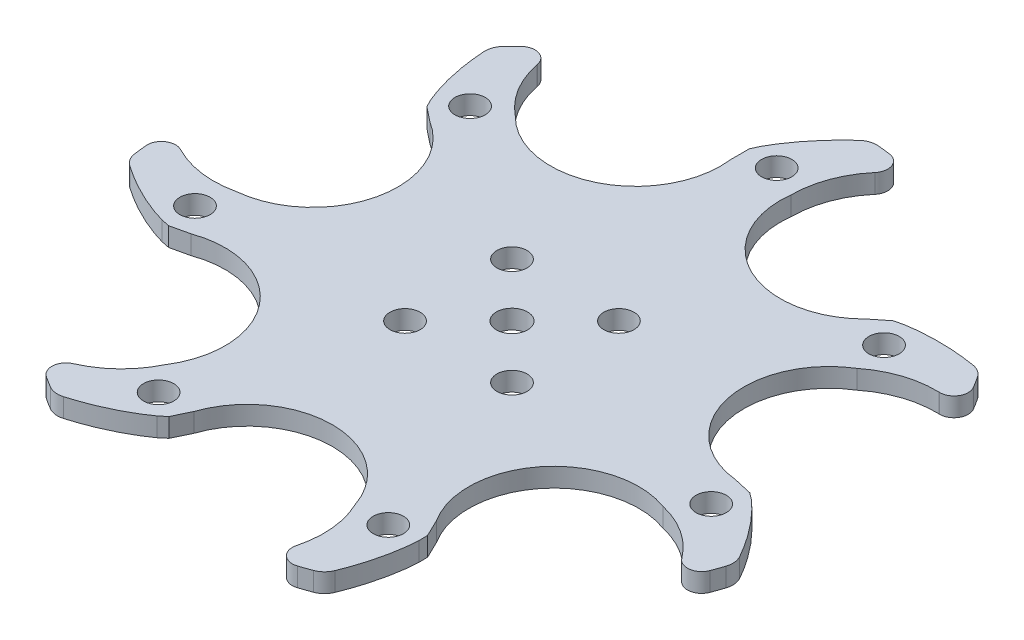
from build123d import *

# Parameters (mm, degrees)
EXTRUDE_1_DEPTH     = 2
MM_PRESS_2_D        = 3.2
MM_PRESS_2_2_D      = 3.2
SKETCH_8_R          = 1.65
CUT_EXTRUDE_1_DEPTH = 49.327311862
EXTRUDE_2_DEPTH     = 2
CUT_EXTRUDE_2_DEPTH = 10


with BuildPart() as part:
    # 草图1 → 凸台-拉伸1 (new body)
    with BuildSketch(Plane(origin=(0, 0, 0), x_dir=(1, 0, 0), z_dir=(0, 1, 0))):
        with BuildLine():
            ThreePointArc((-8.522404447, -25.107142857), (0, -19), (8.522404447, -25.107142857))
            Line((8.522404447, -25.107142857), (10.691823142, -29.611987197))
            ThreePointArc((10.691823142, -29.611987197), (14.983587764, -31.113740589), (16.485341156, -26.821975967))
            Line((16.485341156, -26.821975967), (14.315922461, -22.317131628))
            ThreePointArc((14.315922461, -22.317131628), (14.854798167, -11.846306235), (24.94318698, -8.990963423))
            Line((24.94318698, -8.990963423), (29.817826541, -10.103568092))
            ThreePointArc((29.817826541, -10.103568092), (33.667816096, -7.684459321), (31.248707324, -3.834469766))
            Line((31.248707324, -3.834469766), (26.374067764, -2.721865096))
            ThreePointArc((26.374067764, -2.721865096), (18.523630331, 4.227897745), (22.58124097, 13.895594851))
            Line((22.58124097, 13.895594851), (26.490398382, 17.013043861))
            ThreePointArc((26.490398382, 17.013043861), (26.999492209, 21.53137655), (22.48115952, 22.040470378))
            Line((22.48115952, 22.040470378), (18.572002107, 18.923021369))
            ThreePointArc((18.572002107, 18.923021369), (8.243791043, 17.11840849), (3.215159935, 26.318486784))
            Line((3.215159935, 26.318486784), (3.215159935, 31.318486784))
            ThreePointArc((3.215159935, 31.318486784), (0, 34.533646719), (-3.215159935, 31.318486784))
            Line((-3.215159935, 31.318486784), (-3.215159935, 26.318486784))
            ThreePointArc((-3.215159935, 26.318486784), (-8.243791043, 17.11840849), (-18.572002107, 18.923021369))
            Line((-18.572002107, 18.923021369), (-22.48115952, 22.040470378))
            ThreePointArc((-22.48115952, 22.040470378), (-26.999492209, 21.53137655), (-26.490398382, 17.013043861))
            Line((-26.490398382, 17.013043861), (-22.58124097, 13.895594851))
            ThreePointArc((-22.58124097, 13.895594851), (-18.523630331, 4.227897745), (-26.374067764, -2.721865096))
            Line((-26.374067764, -2.721865096), (-31.248707324, -3.834469766))
            ThreePointArc((-31.248707324, -3.834469766), (-33.667816096, -7.684459321), (-29.817826541, -10.103568092))
            Line((-29.817826541, -10.103568092), (-24.94318698, -8.990963423))
            ThreePointArc((-24.94318698, -8.990963423), (-14.854798167, -11.846306235), (-14.315922461, -22.317131628))
            Line((-14.315922461, -22.317131628), (-16.485341156, -26.821975967))
            ThreePointArc((-16.485341156, -26.821975967), (-14.983587764, -31.113740589), (-10.691823142, -29.611987197))
            Line((-10.691823142, -29.611987197), (-8.522404447, -25.107142857))
        make_face()
    extrude(amount=EXTRUDE_1_DEPTH)

    # mm Press _2 (through all)
    with Locations(Plane(origin=(0, 2, 0), x_dir=(1, 0, 0), z_dir=(0, 1, 0))):
        with Locations((5.655, -5.655), (5.655, 5.655), (-5.655, 5.655), (-5.655, -5.655)):
            Hole(MM_PRESS_2_D / 2)

    # mm Press _2 2 (through all)
    with Locations(Plane(origin=(0, 2, 0), x_dir=(1, 0, 0), z_dir=(0, 1, 0))):
        with Locations((-27.297981541, -6.230586151), (-21.891281509, 17.457714452), (0, 28), (21.891281509, 17.457714452), (27.297981541, -6.230586151), (12.148744695, -25.227128301), (-12.148744695, -25.227128301)):
            Hole(MM_PRESS_2_2_D / 2)

    # 草图8 → 切除-拉伸1 (cut, through all)
    with BuildSketch(Plane(origin=(0, 2, 0), x_dir=(1, 0, 0), z_dir=(0, 1, 0))):
        with Locations(Location((0, 0, 0), (0, 0, 270))):
            Circle(SKETCH_8_R)
    extrude(amount=-CUT_EXTRUDE_1_DEPTH, mode=Mode.SUBTRACT)

    # 草图9 → 凸台-拉伸2 (add)
    with BuildSketch(Plane.XZ):
        with BuildLine():
            ThreePointArc((29.817826541, 10.103568092), (31.7036921, 9.963573711), (33.184658751, 8.787637866))
            add(Edge.make_bspline(
                [(33.184658751, 8.787637866), (33.212444755, 8.833484216), (33.284734799, 8.95360547), (33.400398872, 9.149380685), (33.517732548, 9.352601177), (33.590688856, 9.481453879), (33.620499074, 9.534536524)],
                knots=[0.790412245, 0.790412245, 0.790412245, 0.790412245, 0.80972492, 0.840917534, 0.872328308, 0.894260439, 0.894260439, 0.894260439, 0.894260439], degree=3))
            ThreePointArc((33.620499074, 9.534536524), (33.867349351, 10.321043467), (33.776017877, 11.140303372))
            ThreePointArc((33.776017877, 11.140303372), (33.562238871, 11.768681524), (33.336770484, 12.392960766))
            ThreePointArc((33.336770484, 12.392960766), (32.143995066, 13.355052421), (30.728686654, 12.76748485))
            Line((30.728686654, 12.76748485), (30.714079317, 12.747934687))
            ThreePointArc((30.714079317, 12.747934687), (28.162215888, 10.357049588), (24.94318698, 8.990963423))
            Line((24.94318698, 8.990963423), (29.817826541, 10.103568092))
        make_face()
        with BuildLine():
            ThreePointArc((9.183178553, 31.961441437), (9.46138697, 28.475621793), (8.522404447, 25.107142857))
            Line((8.522404447, 25.107142857), (10.691823142, 29.611987197))
            ThreePointArc((10.691823142, 29.611987197), (11.977093101, 30.999131193), (13.819844369, 31.423813538))
            add(Edge.make_bspline(
                [(13.819844369, 31.423813538), (13.80132454, 31.474122243), (13.752482066, 31.605535252), (13.67153421, 31.818028916), (13.585806381, 32.036469982), (13.530552797, 32.173847866), (13.507637481, 32.23025092)],
                knots=[0.790412245, 0.790412245, 0.790412245, 0.790412245, 0.80972492, 0.840917534, 0.872328308, 0.894260439, 0.894260439, 0.894260439, 0.894260439], degree=3))
            ThreePointArc((13.507637481, 32.23025092), (13.046630222, 32.913625297), (12.349162793, 33.353019671))
            ThreePointArc((12.349162793, 33.353019671), (11.724587941, 33.577667883), (11.095929536, 33.79062134))
            ThreePointArc((11.095929536, 33.79062134), (9.600052681, 33.457926303), (9.177001146, 31.98505124))
            Line((9.177001146, 31.98505124), (9.183178553, 31.961441437))
        make_face()
        with BuildLine():
            ThreePointArc((-19.262842964, 27.107330891), (-16.364059313, 25.15146999), (-14.315922461, 22.317131628))
            Line((-14.315922461, 22.317131628), (-16.485341156, 26.821975967))
            ThreePointArc((-16.485341156, 26.821975967), (-16.768501291, 28.69171062), (-15.951594696, 30.397216687))
            add(Edge.make_bspline(
                [(-15.951594696, 30.397216687), (-16.00247455, 30.414104266), (-16.135670161, 30.457852353), (-16.352274561, 30.527052404), (-16.57650909, 30.596223465), (-16.718365491, 30.638678182), (-16.776750641, 30.655928996)],
                knots=[0.790412245, 0.790412245, 0.790412245, 0.790412245, 0.80972492, 0.840917534, 0.872328308, 0.894260439, 0.894260439, 0.894260439, 0.894260439], degree=3))
            ThreePointArc((-16.776750641, 30.655928996), (-17.598467567, 30.721575963), (-18.376863751, 30.450231879))
            ThreePointArc((-18.376863751, 30.450231879), (-18.941916847, 30.101985466), (-19.500372669, 29.743254842))
            ThreePointArc((-19.500372669, 29.743254842), (-20.172925177, 28.366299261), (-19.285153402, 27.117221671))
            Line((-19.285153402, 27.117221671), (-19.262842964, 27.107330891))
        make_face()
        with BuildLine():
            ThreePointArc((-33.203550839, 1.840847295), (-29.867035167, 2.887748289), (-26.374067764, 2.721865096))
            Line((-26.374067764, 2.721865096), (-31.248707324, 3.834469766))
            ThreePointArc((-31.248707324, 3.834469766), (-32.887072196, 4.778846746), (-33.711157602, 6.48089568))
            add(Edge.make_bspline(
                [(-33.711157602, 6.48089568), (-33.756083912, 6.451645442), (-33.87333365, 6.374785406), (-34.062487062, 6.248582793), (-34.256375118, 6.11639663), (-34.378013572, 6.031958913), (-34.427903346, 5.997067271)],
                knots=[0.790412245, 0.790412245, 0.790412245, 0.790412245, 0.80972492, 0.840917534, 0.872328308, 0.894260439, 0.894260439, 0.894260439, 0.894260439], degree=3))
            ThreePointArc((-34.427903346, 5.997067271), (-34.991560335, 5.395553323), (-35.264737071, 4.617798412))
            ThreePointArc((-35.264737071, 4.617798412), (-35.344771904, 3.958894025), (-35.412496518, 3.298610796))
            ThreePointArc((-35.412496518, 3.298610796), (-34.755278925, 1.914270308), (-33.225194093, 1.829571092))
            Line((-33.225194093, 1.829571092), (-33.203550839, 1.840847295))
        make_face()
        with BuildLine():
            ThreePointArc((-24.658288206, -25.629954459), (-23.166198763, -25.97924323), (-22.145985961, -24.835783835))
            Line((-22.145985961, -24.835783835), (-22.141307703, -24.811831861))
            ThreePointArc((-22.141307703, -24.811831861), (-20.879524364, -21.550506773), (-18.572002107, -18.923021369))
            Line((-18.572002107, -18.923021369), (-22.48115952, -22.040470378))
            ThreePointArc((-22.48115952, -22.040470378), (-24.241006963, -22.732586198), (-26.085531251, -22.31567196))
            add(Edge.make_bspline(
                [(-26.085531251, -22.31567196), (-26.09067359, -22.36903399), (-26.10368601, -22.508624974), (-26.122952057, -22.735197109), (-26.140491979, -22.969201619), (-26.150316249, -23.116948448), (-26.154142631, -23.177708427)],
                knots=[0.790412245, 0.790412245, 0.790412245, 0.790412245, 0.80972492, 0.840917534, 0.872328308, 0.894260439, 0.894260439, 0.894260439, 0.894260439], degree=3))
            ThreePointArc((-26.154142631, -23.177708427), (-26.035294473, -23.993431018), (-25.597544107, -24.691931446))
            ThreePointArc((-25.597544107, -24.691931446), (-25.132292815, -25.165325364), (-24.658288206, -25.629954459))
        make_face()
        with BuildLine():
            ThreePointArc((3.215159935, -31.318486784), (2.65903094, -33.125918075), (1.18303218, -34.308083458))
            add(Edge.make_bspline(
                [(1.18303218, -34.308083458), (1.221546098, -34.345374581), (1.322569614, -34.442581656), (1.487698657, -34.598909874), (1.659714789, -34.758522563), (1.769102579, -34.858322127), (1.814220933, -34.899196941)],
                knots=[0.790412245, 0.790412245, 0.790412245, 0.790412245, 0.80972492, 0.840917534, 0.872328308, 0.894260439, 0.894260439, 0.894260439, 0.894260439], degree=3))
            ThreePointArc((1.814220933, -34.899196941), (2.52607915, -35.314872426), (3.345121665, -35.408133301))
            ThreePointArc((3.345121665, -35.408133301), (4.005315368, -35.339541475), (4.664114062, -35.258641251))
            ThreePointArc((4.664114062, -35.258641251), (5.867501571, -34.309856737), (5.609601295, -32.799286977))
            Line((5.609601295, -32.799286977), (5.593791734, -32.780695556))
            ThreePointArc((5.593791734, -32.780695556), (3.83069415, -29.760790685), (3.215159935, -26.318486784))
            Line((3.215159935, -26.318486784), (3.215159935, -31.318486784))
        make_face()
        with BuildLine():
            ThreePointArc((26.490398382, -17.013043861), (27.55676431, -18.574757995), (27.56074825, -20.465808354))
            add(Edge.make_bspline(
                [(27.56074825, -20.465808354), (27.61391666, -20.458947596), (27.752903343, -20.440571851), (27.97808194, -20.408937815), (28.210122468, -20.373967072), (28.356351081, -20.350668265), (28.416439131, -20.340878344)],
                knots=[0.790412245, 0.790412245, 0.790412245, 0.790412245, 0.80972492, 0.840917534, 0.872328308, 0.894260439, 0.894260439, 0.894260439, 0.894260439], degree=3))
            ThreePointArc((28.416439131, -20.340878344), (29.185263651, -20.043494605), (29.768842594, -19.461288586))
            ThreePointArc((29.768842594, -19.461288586), (30.126839386, -18.90236206), (30.474343312, -18.336852036))
            ThreePointArc((30.474343312, -18.336852036), (30.482853548, -16.804448327), (29.141044361, -16.064258042))
            Line((29.141044361, -16.064258042), (29.116651902, -16.065026893))
            ThreePointArc((29.116651902, -16.065026893), (25.656321837, -15.560592202), (22.58124097, -13.895594851))
            Line((22.58124097, -13.895594851), (26.490398382, -17.013043861))
        make_face()
    extrude(amount=-EXTRUDE_2_DEPTH)

    # 草图10 → 切除-拉伸2 (cut)
    with BuildSketch(Plane.XZ):
        with BuildLine():
            Line((29.032198584, 3.712254696), (28.312582717, 3.164318484))
            Line((28.312582716, 3.164318484), (31.248707324, 3.834469766))
            ThreePointArc((31.248707324, 3.834469766), (33.527821714, 5.798593762), (33.184658751, 8.787637866))
            add(Edge.make_bspline(
                [(29.032198584, 3.712254696), (29.07336573, 3.748731887), (29.156787944, 3.822650251), (29.282094586, 3.936557796), (29.409471852, 4.054520385), (29.676591101, 4.307005221), (30.038604175, 4.667248491), (30.491903924, 5.150673711), (30.910968793, 5.62530964), (31.333991802, 6.134386446), (31.757858219, 6.676746667), (32.228894866, 7.318189582), (32.709014608, 8.0225916), (33.036301483, 8.542851347), (33.184658751, 8.787637866)],
                knots=[0, 0, 0, 0, 0.019814698, 0.040153039, 0.06100407, 0.08235681, 0.172565022, 0.244952026, 0.32107033, 0.400635879, 0.483373462, 0.569018146, 0.687296458, 0.790412245, 0.790412245, 0.790412245, 0.790412245], degree=3))
        make_face()
        with BuildLine():
            Line((21.003637335, -20.383733914), (20.1265704, -20.162748213))
            Line((20.1265704, -20.162748213), (22.48115952, -22.040470378))
            ThreePointArc((22.48115952, -22.040470378), (25.437778075, -22.597742479), (27.56074825, -20.465808354))
            add(Edge.make_bspline(
                [(21.003637335, -20.383733914), (21.057823647, -20.393176527), (21.167628251, -20.412311294), (21.334812169, -20.439259779), (21.506457462, -20.465298865), (21.870404182, -20.516719383), (22.377765172, -20.575144597), (23.038349999, -20.628137917), (23.670717983, -20.659845362), (24.332480789, -20.673173872), (25.020791473, -20.666409915), (25.815978284, -20.634748079), (26.666051721, -20.570933334), (27.276867199, -20.50243987), (27.56074825, -20.465808354)],
                knots=[0, 0, 0, 0, 0.019814698, 0.040153039, 0.06100407, 0.08235681, 0.172565022, 0.244952026, 0.32107033, 0.400635879, 0.483373462, 0.569018146, 0.687296458, 0.790412245, 0.790412245, 0.790412245, 0.790412245], degree=3))
        make_face()
        with BuildLine():
            ThreePointArc((16.485341156, 26.821975967), (16.37073176, 29.828470631), (13.819844369, 31.423813538))
            add(Edge.make_bspline(
                [(15.198922151, 25.012839803), (15.19607043, 25.06776873), (15.190291625, 25.17907819), (15.179362534, 25.34806706), (15.166554094, 25.521203089), (15.135699628, 25.887467047), (15.079761559, 26.39510827), (14.984432273, 27.05092298), (14.874629632, 27.674491749), (14.740367891, 28.322628652), (14.580609983, 28.992176828), (14.372796264, 29.760381224), (14.121422353, 30.574941428), (13.918726932, 31.155201257), (13.819844369, 31.423813538)],
                knots=[0, 0, 0, 0, 0.019814698, 0.040153039, 0.06100407, 0.08235681, 0.172565022, 0.244952026, 0.32107033, 0.400635879, 0.483373462, 0.569018146, 0.687296458, 0.790412245, 0.790412245, 0.790412245, 0.790412245], degree=3))
            Line((15.198922151, 25.012839803), (15.178642776, 24.108588823))
            Line((15.178642776, 24.108588823), (16.485341156, 26.821975967))
        make_face()
        with BuildLine():
            ThreePointArc((-10.691823142, 29.611987197), (-13.113853112, 31.396900724), (-15.951594696, 30.397216687))
            add(Edge.make_bspline(
                [(-10.079452664, 27.47824637), (-10.124175848, 27.51026443), (-10.214804113, 27.575146692), (-10.353739109, 27.671964821), (-10.497088238, 27.769899328), (-10.802682376, 27.974138178), (-11.234449083, 28.24691316), (-11.806622506, 28.581275506), (-12.362609028, 28.884217113), (-12.95305369, 29.183353807), (-13.57613496, 29.475906505), (-14.306311076, 29.792398803), (-15.099888959, 30.103736746), (-15.679932888, 30.30704917), (-15.951594696, 30.397216687)],
                knots=[0, 0, 0, 0, 0.019814698, 0.040153039, 0.06100407, 0.08235681, 0.172565022, 0.244952026, 0.32107033, 0.400635879, 0.483373462, 0.569018146, 0.687296458, 0.790412245, 0.790412245, 0.790412245, 0.790412245], degree=3))
            Line((-10.079452664, 27.47824637), (-9.385124762, 26.898600052))
            Line((-9.385124762, 26.898600052), (-10.691823142, 29.611987197))
        make_face()
        with BuildLine():
            ThreePointArc((-29.817826541, 10.103568092), (-32.723439116, 9.322824192), (-33.711157602, 6.48089568))
            add(Edge.make_bspline(
                [(-27.767794039, 9.251972966), (-27.820711216, 9.236969907), (-27.92794401, 9.206567304), (-28.090264024, 9.158308667), (-28.256209026, 9.107294971), (-28.606424217, 8.995712693), (-29.088890424, 8.828216308), (-29.707049727, 8.589344625), (-30.290550939, 8.343537861), (-30.892561649, 8.068418313), (-31.509773376, 7.763677384), (-32.212474381, 7.390132429), (-32.950675903, 6.963804289), (-33.471283432, 6.637070907), (-33.711157602, 6.48089568)],
                knots=[0, 0, 0, 0, 0.019814698, 0.040153039, 0.06100407, 0.08235681, 0.172565022, 0.244952026, 0.32107033, 0.400635879, 0.483373462, 0.569018146, 0.687296458, 0.790412245, 0.790412245, 0.790412245, 0.790412245], degree=3))
            Line((-27.767794039, 9.251972966), (-26.881701933, 9.433416811))
            Line((-26.881701933, 9.433416811), (-29.817826541, 10.103568092))
        make_face()
        with BuildLine():
            ThreePointArc((-26.490398382, -17.013043861), (-27.69160803, -19.771529107), (-26.085531251, -22.31567196))
            add(Edge.make_bspline(
                [(-24.546420143, -15.941224787), (-24.5676836, -15.991951356), (-24.610772441, -16.094745043), (-24.674247193, -16.251740709), (-24.737828095, -16.413288254), (-24.868945158, -16.756667929), (-25.03880397, -17.238307486), (-25.23746259, -17.870537949), (-25.409090178, -18.479995578), (-25.569340592, -19.122200736), (-25.715909757, -19.794759156), (-25.861987462, -20.577054395), (-25.988931821, -21.420014833), (-26.058074861, -22.030757121), (-26.085531251, -22.31567196)],
                knots=[0, 0, 0, 0, 0.019814698, 0.040153039, 0.06100407, 0.08235681, 0.172565022, 0.244952026, 0.32107033, 0.400635879, 0.483373462, 0.569018146, 0.687296458, 0.790412245, 0.790412245, 0.790412245, 0.790412245], degree=3))
            Line((-24.546420143, -15.941224787), (-24.135809262, -15.135321696))
            Line((-24.135809262, -15.135321696), (-26.490398382, -17.013043861))
        make_face()
        with BuildLine():
            Line((-2.841091224, -29.130355134), (-3.215159935, -28.306854261))
            Line((-3.215159935, -28.306854261), (-3.215159935, -31.318486784))
            ThreePointArc((-3.215159935, -31.318486784), (-1.807431291, -33.977517723), (1.18303218, -34.308083458))
            add(Edge.make_bspline(
                [(-2.841091224, -29.130355134), (-2.814689143, -29.178607072), (-2.761187256, -29.2763861), (-2.678018962, -29.423897856), (-2.591358049, -29.574330654), (-2.404643161, -29.890935827), (-2.133987429, -30.324034147), (-1.763551372, -30.873540956), (-1.394066262, -31.387715423), (-0.99188455, -31.913412609), (-0.557441583, -32.447338313), (-0.036896496, -33.049299564), (0.543008, -33.674125897), (0.977395568, -34.108975691), (1.18303218, -34.308083458)],
                knots=[0, 0, 0, 0, 0.019814698, 0.040153039, 0.06100407, 0.08235681, 0.172565022, 0.244952026, 0.32107033, 0.400635879, 0.483373462, 0.569018146, 0.687296458, 0.790412245, 0.790412245, 0.790412245, 0.790412245], degree=3))
        make_face()
    extrude(amount=-CUT_EXTRUDE_2_DEPTH, mode=Mode.SUBTRACT)


solid = part.part
